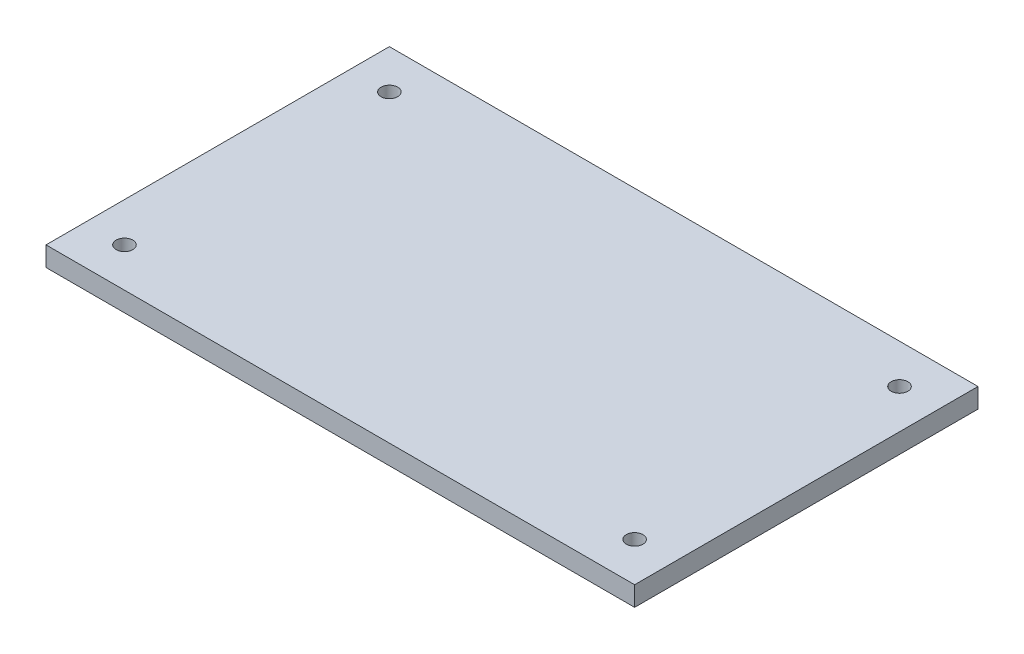
from build123d import *

# Parameters (mm, degrees)
SKETCH1_W           = 120
SKETCH1_H           = 70
SKETCH1_R           = 1.7
BOSS_EXTRUDE1_DEPTH = 4


with BuildPart() as part:
    # Sketch1 → Boss-Extrude1 (new body)
    with BuildSketch(Plane(origin=(0, 0, 0), x_dir=(1, 0, 0), z_dir=(0, 1, 0))):
        with Locations((60, 35)):
            Rectangle(SKETCH1_W, SKETCH1_H)
        with Locations(Location((8, 62, 0), (0, 0, 270))):
            Circle(SKETCH1_R, mode=Mode.SUBTRACT)
        with Locations(Location((112, 62, 0), (0, 0, 270))):
            Circle(SKETCH1_R, mode=Mode.SUBTRACT)
        with Locations(Location((112, 8, 0), (0, 0, 270))):
            Circle(SKETCH1_R, mode=Mode.SUBTRACT)
        with Locations(Location((8, 8, 0), (0, 0, 270))):
            Circle(SKETCH1_R, mode=Mode.SUBTRACT)
    extrude(amount=BOSS_EXTRUDE1_DEPTH)


solid = part.part
